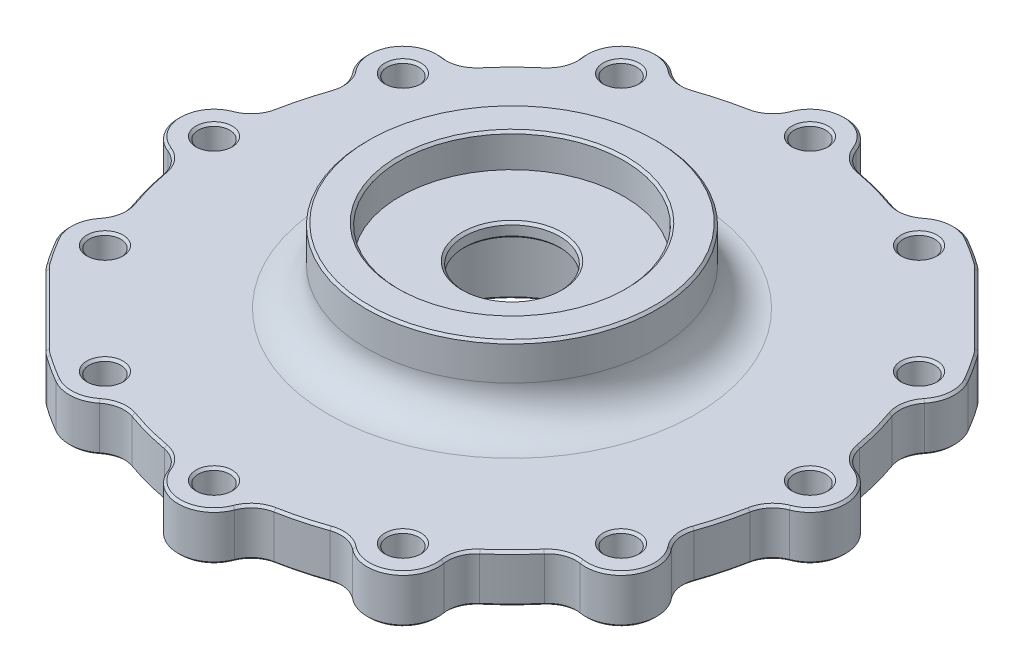
from build123d import *

# Parameters (mm, degrees)
M6_CLEARANCE_HOLE1_D = 6.6
M6_CLEARANCE_HOLE2_D = 6.6
CUT_EXTRUDE1_DEPTH   = 101.216565497
CHAMFER1_SIZE        = 0.5


with BuildPart() as part:
    # Sketch1 → Revolve1 (revolve)
    with BuildSketch(Plane.XY, mode=Mode.PRIVATE) as revolve1_sk:
        with BuildLine():
            Line((-30.5, -8.698290186), (-30.5, -1.098290186))
            Line((-30.5, -1.098290186), (-23.5, -1.098290186))
            Line((-23.5, -1.098290186), (-23.5, -8.098290186))
            Line((-23.5, -8.098290186), (-10, -8.098290186))
            Line((-10, -8.098290186), (-10, -11.098290186))
            Line((-10, -11.098290186), (-23.5, -11.098290186))
            Line((-23.5, -11.098290186), (-23.5, -31.698290186))
            Line((-23.5, -31.698290186), (-45, -31.698290186))
            Line((-45, -31.698290186), (-45, -26.698290186))
            Line((-45, -26.698290186), (-70, -26.698290186))
            Line((-70, -26.698290186), (-70, -16.698290186))
            Line((-70, -16.698290186), (-38.5, -16.698290186))
            ThreePointArc((-38.5, -16.698290186), (-32.843145751, -14.355144435), (-30.5, -8.698290186))
        make_face()
    revolve(revolve1_sk.sketch.rotate(Axis((0, 95.786399453, 0), (0, -1, 0)), 270), axis=Axis((0, 95.786399453, 0), (0, -1, 0)))

    # M6 Clearance Hole1 (through all)
    with Locations(Plane(origin=(0, -16.698290186, 0), x_dir=(1, 0, 0), z_dir=(0, 1, 0))):
        with Locations((-31.25, 54.126587737), (0, 62.5), (31.25, 54.126587737), (54.126587737, 31.25), (62.5, 0), (54.126587737, -31.25), (31.25, -54.126587737), (0, -62.5), (-31.25, -54.126587737), (-54.126587737, -31.25), (-62.5, 0), (-54.126587737, 31.25)):
            Hole(M6_CLEARANCE_HOLE1_D / 2)

    # M6 Clearance Hole2 (through all)
    with Locations(Plane(origin=(0, -16.698290186, 0), x_dir=(1, 0, 0), z_dir=(0, 1, 0))):
        with Locations((0, 0), (31.25, -54.126587737), (0, -62.5), (-31.25, -54.126587737), (-54.126587737, -31.25), (-62.5, 0), (-54.126587737, 31.25), (-31.25, 54.126587737), (0, 62.5), (31.25, 54.126587737), (54.126587737, 31.25), (62.5, 0), (54.126587737, -31.25)):
            Hole(M6_CLEARANCE_HOLE2_D / 2)

    # Sketch6 → Cut-Extrude1 (cut, through all)
    with BuildSketch(Plane(origin=(0, -16.698290186, 0), x_dir=(1, 0, 0), z_dir=(0, 1, 0))):
        with BuildLine():
            ThreePointArc((-7.003550687, 65.183333333), (-4.249999994, 68.679603551), (1.5e-08, 70))
            ThreePointArc((1.5e-08, 70), (-18.117332822, 67.61480793), (-34.999999412, 60.621778604))
            ThreePointArc((-34.999999412, 60.621778604), (-30.659193469, 61.603281367), (-26.526413855, 59.952197913))
            ThreePointArc((-26.526413855, 59.952197913), (-23.770921754, 58.700605212), (-20.755059251, 58.953180707))
            ThreePointArc((-20.755059251, 58.953180707), (-16.176190319, 60.370364143), (-11.502181785, 61.432481752))
            ThreePointArc((-11.502181785, 61.432481752), (-8.764080496, 62.721676208), (-7.003550687, 65.183333333))
        make_face()
        with BuildLine():
            ThreePointArc((26.526413855, 59.952197913), (30.659193807, 61.603281394), (35, 60.621778265))
            ThreePointArc((35, 60.621778265), (18.117333164, 67.614807838), (1.5e-08, 70))
            ThreePointArc((1.5e-08, 70), (4.250000006, 68.679603543), (7.003550687, 65.183333333))
            ThreePointArc((7.003550687, 65.183333333), (8.764080496, 62.721676208), (11.502181785, 61.432481752))
            ThreePointArc((11.502181785, 61.432481752), (16.176190319, 60.370364143), (20.755059251, 58.953180707))
            ThreePointArc((20.755059251, 58.953180707), (23.770921754, 58.700605212), (26.526413855, 59.952197913))
        make_face()
        with BuildLine():
            ThreePointArc((-38.656919478, 52.948647227), (-38.020409594, 57.3532817), (-34.999999412, 60.621778604))
            ThreePointArc((-34.999999412, 60.621778604), (-49.497474345, 49.497475021), (-60.621778126, 35.000000241))
            ThreePointArc((-60.621778126, 35.000000241), (-57.353281268, 38.0204098), (-52.948647227, 38.656919478))
            ThreePointArc((-52.948647227, 38.656919478), (-49.936524716, 38.950754454), (-47.450998922, 40.677422501))
            ThreePointArc((-47.450998922, 40.677422501), (-44.194173824, 44.194173824), (-40.677422501, 47.450998922))
            ThreePointArc((-40.677422501, 47.450998922), (-38.950754454, 49.936524716), (-38.656919478, 52.948647227))
        make_face()
        with BuildLine():
            ThreePointArc((-59.952197913, 26.526413855), (-61.603281405, 30.659193946), (-60.621778126, 35.000000241))
            ThreePointArc((-60.621778126, 35.000000241), (-67.614807771, 18.117333416), (-70, 2.57e-07))
            ThreePointArc((-70, 2.57e-07), (-68.679603474, 4.250000106), (-65.183333333, 7.003550687))
            ThreePointArc((-65.183333333, 7.003550687), (-62.721676208, 8.764080496), (-61.432481752, 11.502181785))
            ThreePointArc((-61.432481752, 11.502181785), (-60.370364143, 16.176190319), (-58.953180707, 20.755059251))
            ThreePointArc((-58.953180707, 20.755059251), (-58.700605212, 23.770921754), (-59.952197913, 26.526413855))
        make_face()
        with BuildLine():
            ThreePointArc((-65.183333333, -7.003550687), (-68.67960362, -4.249999894), (-70, 2.57e-07))
            ThreePointArc((-70, 2.57e-07), (-67.614807873, -18.117333033), (-60.621778265, -35))
            ThreePointArc((-60.621778265, -35), (-61.603281394, -30.659193807), (-59.952197913, -26.526413855))
            ThreePointArc((-59.952197913, -26.526413855), (-58.700605212, -23.770921754), (-58.953180707, -20.755059251))
            ThreePointArc((-58.953180707, -20.755059251), (-60.370364143, -16.176190319), (-61.432481752, -11.502181785))
            ThreePointArc((-61.432481752, -11.502181785), (-62.721676208, -8.764080496), (-65.183333333, -7.003550687))
        make_face()
        with BuildLine():
            ThreePointArc((-35, -60.621778265), (-18.117333226, -67.614807822), (-1.43e-07, -70))
            ThreePointArc((-1.43e-07, -70), (-4.250000059, -68.679603507), (-7.003550687, -65.183333333))
            ThreePointArc((-7.003550687, -65.183333333), (-8.764080496, -62.721676208), (-11.502181785, -61.432481752))
            ThreePointArc((-11.502181785, -61.432481752), (-16.176190319, -60.370364143), (-20.755059251, -58.953180707))
            ThreePointArc((-20.755059251, -58.953180707), (-23.770921754, -58.700605212), (-26.526413855, -59.952197913))
            ThreePointArc((-26.526413855, -59.952197913), (-30.659193807, -61.603281394), (-35, -60.621778265))
        make_face()
        with BuildLine():
            ThreePointArc((-1.43e-07, -70), (18.117333048, -67.61480787), (34.999999928, -60.621778307))
            ThreePointArc((34.999999928, -60.621778307), (30.659193766, -61.60328139), (26.526413855, -59.952197913))
            ThreePointArc((26.526413855, -59.952197913), (23.770921754, -58.700605212), (20.755059251, -58.953180707))
            ThreePointArc((20.755059251, -58.953180707), (16.176190319, -60.370364143), (11.502181785, -61.432481752))
            ThreePointArc((11.502181785, -61.432481752), (8.764080496, -62.721676208), (7.003550687, -65.183333333))
            ThreePointArc((7.003550687, -65.183333333), (4.249999941, -68.679603588), (-1.43e-07, -70))
        make_face()
        with BuildLine():
            ThreePointArc((34.999999928, -60.621778307), (49.497474453, -49.497474913), (60.621777982, -35.00000049))
            ThreePointArc((60.621777982, -35.00000049), (57.353281138, -38.020409861), (52.948647227, -38.656919478))
            ThreePointArc((52.948647227, -38.656919478), (49.936524716, -38.950754454), (47.450998922, -40.677422501))
            ThreePointArc((47.450998922, -40.677422501), (44.194173824, -44.194173824), (40.677422501, -47.450998922))
            ThreePointArc((40.677422501, -47.450998922), (38.950754454, -49.936524716), (38.656919478, -52.948647227))
            ThreePointArc((38.656919478, -52.948647227), (38.020409722, -57.353281431), (34.999999928, -60.621778307))
        make_face()
        with BuildLine():
            ThreePointArc((60.621777982, -35.00000049), (67.614807767, -18.117333431), (70, 0))
            ThreePointArc((70, 0), (68.679603547, -4.25), (65.183333333, -7.003550687))
            ThreePointArc((65.183333333, -7.003550687), (62.721676208, -8.764080496), (61.432481752, -11.502181785))
            ThreePointArc((61.432481752, -11.502181785), (60.370364143, -16.176190319), (58.953180707, -20.755059251))
            ThreePointArc((58.953180707, -20.755059251), (58.700605212, -23.770921754), (59.952197913, -26.526413855))
            ThreePointArc((59.952197913, -26.526413855), (61.603281416, -30.65919409), (60.621777982, -35.00000049))
        make_face()
        with BuildLine():
            ThreePointArc((70, 0), (67.61480784, 18.117333157), (60.621778265, 35))
            ThreePointArc((60.621778265, 35), (61.603281394, 30.659193807), (59.952197913, 26.526413855))
            ThreePointArc((59.952197913, 26.526413855), (58.700605212, 23.770921754), (58.953180707, 20.755059251))
            ThreePointArc((58.953180707, 20.755059251), (60.370364143, 16.176190319), (61.432481752, 11.502181785))
            ThreePointArc((61.432481752, 11.502181785), (62.721676208, 8.764080496), (65.183333333, 7.003550687))
            ThreePointArc((65.183333333, 7.003550687), (68.679603547, 4.25), (70, 0))
        make_face()
        with BuildLine():
            ThreePointArc((-57.238204351, -40.296252465), (-49.497474683, -49.497474683), (-40.296252465, -57.238204351))
            ThreePointArc((-40.296252465, -57.238204351), (-40.977270471, -56.713571141), (-41.610712782, -56.132385827))
            Line((-41.610712782, -56.132385827), (-56.132385827, -41.610712782))
            ThreePointArc((-56.132385827, -41.610712782), (-56.713571141, -40.977270471), (-57.238204351, -40.296252465))
        make_face()
        with BuildLine():
            Line((41.610712782, 56.132385827), (56.132385827, 41.610712782))
            ThreePointArc((56.132385827, 41.610712782), (56.713571141, 40.977270471), (57.238204351, 40.296252465))
            ThreePointArc((57.238204351, 40.296252465), (49.497474683, 49.497474683), (40.296252465, 57.238204351))
            ThreePointArc((40.296252465, 57.238204351), (40.977270471, 56.713571141), (41.610712782, 56.132385827))
        make_face()
    extrude(amount=-CUT_EXTRUDE1_DEPTH, mode=Mode.SUBTRACT)

    # Chamfer1
    chamfer1_edges = [part.edges().sort_by_distance(p)[0] for p in [
        (57.426587737, -26.698290186, -31.25),
        (57.426587737, -16.698290186, -31.25),
        (34.55, -26.698290186, -54.126587737),
        (34.55, -16.698290186, -54.126587737),
        (3.3, -26.698290186, -62.5),
        (3.3, -16.698290186, -62.5),
        (0, -1.098290186, -30.5),
        (0, -1.098290186, -23.5),
        (0, -8.098290186, -10),
        (0, -11.098290186, -10),
        (0, -31.698290186, -23.5),
        (0, -31.698290186, -45),
        (0, -26.698290186, -45),
        (62.721676208, -26.698290186, 8.764080496),
        (60.370364143, -26.698290186, 16.176190319),
        (58.700605212, -26.698290186, 23.770921754),
        (60.621778265, -26.698290186, 35),
        (70, -26.698290186, 0),
        (8.764080496, -26.698290186, 62.721676208),
        (0, -26.698290186, 70),
        (16.176190319, -26.698290186, 60.370364143),
        (23.770921754, -26.698290186, 58.700605212),
        (35, -26.698290186, 60.621778265),
        (-62.721676208, -26.698290186, -8.764080496),
        (-60.370364143, -26.698290186, -16.176190319),
        (-58.700605212, -26.698290186, -23.770921754),
        (-60.621778265, -26.698290186, -35),
        (-70, -26.698290186, 0),
        (-23.770921754, -26.698290186, -58.700605212),
        (-16.176190319, -26.698290186, -60.370364143),
        (-8.764080496, -26.698290186, -62.721676208),
        (0, -26.698290186, -70),
        (-35, -26.698290186, -60.621778265),
        (-35, -16.698290186, -60.621778265),
        (0, -16.698290186, -70),
        (-16.176190319, -16.698290186, -60.370364143),
        (-23.770921754, -16.698290186, -58.700605212),
        (-8.764080496, -16.698290186, -62.721676208),
        (-70, -16.698290186, 0),
        (-60.621778265, -16.698290186, -35),
        (-60.370364143, -16.698290186, -16.176190319),
        (-62.721676208, -16.698290186, -8.764080496),
        (-58.700605212, -16.698290186, -23.770921754),
        (16.176190319, -16.698290186, 60.370364143),
        (35, -16.698290186, 60.621778265),
        (0, -16.698290186, 70),
        (8.764080496, -16.698290186, 62.721676208),
        (23.770921754, -16.698290186, 58.700605212),
        (70, -16.698290186, 0),
        (60.621778265, -16.698290186, 35),
        (60.370364143, -16.698290186, 16.176190319),
        (62.721676208, -16.698290186, 8.764080496),
        (58.700605212, -16.698290186, 23.770921754),
        (-49.936524716, -26.698290186, -38.950754454),
        (-44.194173824, -26.698290186, -44.194173824),
        (-38.950754454, -26.698290186, -49.936524716),
        (8.764080496, -26.698290186, -62.721676208),
        (16.176190319, -26.698290186, -60.370364143),
        (23.770921754, -26.698290186, -58.700605212),
        (30.659193807, -26.698290186, -61.603281394),
        (30.659193807, -16.698290186, -61.603281394),
        (16.176190319, -16.698290186, -60.370364143),
        (8.764080496, -16.698290186, -62.721676208),
        (23.770921754, -16.698290186, -58.700605212),
        (-44.194173824, -16.698290186, -44.194173824),
        (-49.936524716, -16.698290186, -38.950754454),
        (-38.950754454, -16.698290186, -49.936524716),
        (-58.989460483, -26.698290186, 37.686118823),
        (-58.989460483, -16.698290186, 37.686118823),
        (-8.764080496, -26.698290186, 62.721676208),
        (-16.176190319, -26.698290186, 60.370364143),
        (-23.770921754, -26.698290186, 58.700605212),
        (-58.700605212, -26.698290186, 23.770921754),
        (-60.370364143, -26.698290186, 16.176190319),
        (-62.721676208, -26.698290186, 8.764080496),
        (-61.603281394, -26.698290186, 30.659193807),
        (-61.603281394, -16.698290186, 30.659193807),
        (-60.370364143, -16.698290186, 16.176190319),
        (-58.700605212, -16.698290186, 23.770921754),
        (-62.721676208, -16.698290186, 8.764080496),
        (-30.659193807, -26.698290186, 61.603281394),
        (-30.659193807, -16.698290186, 61.603281394),
        (-16.176190319, -16.698290186, 60.370364143),
        (-8.764080496, -16.698290186, 62.721676208),
        (-23.770921754, -16.698290186, 58.700605212),
        (49.936524716, -26.698290186, 38.950754454),
        (44.194173824, -26.698290186, 44.194173824),
        (38.950754454, -26.698290186, 49.936524716),
        (44.194173824, -16.698290186, 44.194173824),
        (49.936524716, -16.698290186, 38.950754454),
        (38.950754454, -16.698290186, 49.936524716),
        (58.989460483, -26.698290186, -37.686118823),
        (37.686118823, -26.698290186, -58.989460483),
        (58.989460483, -16.698290186, -37.686118823),
        (37.686118823, -16.698290186, -58.989460483),
        (-37.686118823, -26.698290186, 58.989460483),
        (-37.686118823, -16.698290186, 58.989460483),
        (48.871549304, -26.698290186, -48.871549304),
        (-48.871549304, -26.698290186, 48.871549304),
        (58.700605212, -26.698290186, -23.770921754),
        (60.370364143, -26.698290186, -16.176190319),
        (62.721676208, -26.698290186, -8.764080496),
        (61.603281394, -26.698290186, -30.659193807),
        (61.603281394, -16.698290186, -30.659193807),
        (60.370364143, -16.698290186, -16.176190319),
        (58.700605212, -16.698290186, -23.770921754),
        (62.721676208, -16.698290186, -8.764080496),
        (-40.977270471, -26.698290186, 56.713571141),
        (-40.977270471, -16.698290186, 56.713571141),
        (-56.713571141, -26.698290186, 40.977270471),
        (-56.713571141, -16.698290186, 40.977270471),
        (-48.871549304, -16.698290186, 48.871549304),
        (-27.95, -26.698290186, -54.126587737),
        (-27.95, -16.698290186, -54.126587737),
        (40.977270471, -26.698290186, -56.713571141),
        (40.977270471, -16.698290186, -56.713571141),
        (56.713571141, -26.698290186, -40.977270471),
        (56.713571141, -16.698290186, -40.977270471),
        (48.871549304, -16.698290186, -48.871549304),
        (-50.826587737, -26.698290186, -31.25),
        (-50.826587737, -16.698290186, -31.25),
        (-59.2, -26.698290186, 0),
        (-59.2, -16.698290186, 0),
        (-50.826587737, -26.698290186, 31.25),
        (-50.826587737, -16.698290186, 31.25),
        (-27.95, -26.698290186, 54.126587737),
        (-27.95, -16.698290186, 54.126587737),
        (3.3, -26.698290186, 62.5),
        (3.3, -16.698290186, 62.5),
        (34.55, -26.698290186, 54.126587737),
        (34.55, -16.698290186, 54.126587737),
        (57.426587737, -26.698290186, 31.25),
        (57.426587737, -16.698290186, 31.25),
        (65.8, -26.698290186, 0),
        (65.8, -16.698290186, 0),
    ]]
    chamfer(chamfer1_edges, length=CHAMFER1_SIZE)


solid = part.part
